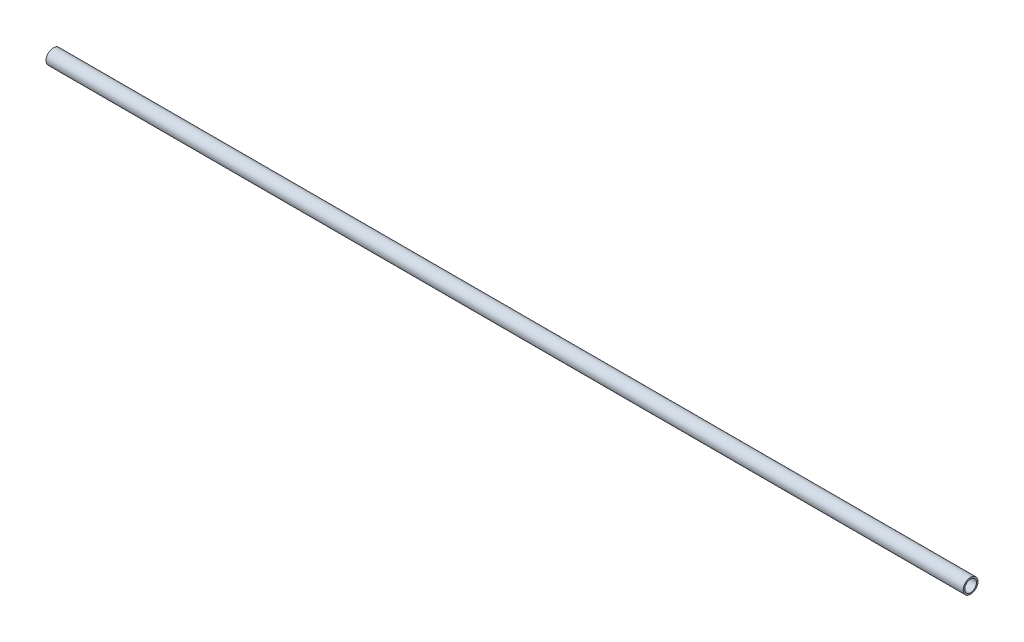
from build123d import *

# Parameters (mm, degrees)
SKETCH2_R           = 8.05
SKETCH2_R_2         = 6.4
BOSS_EXTRUDE1_DEPTH = 1000


with BuildPart() as part:
    # Sketch2 → Boss-Extrude1 (new body)
    with BuildSketch(Plane(origin=(0, 0, 0), x_dir=(0, 0, -1), z_dir=(1, 0, 0))):
        Circle(SKETCH2_R)
        Circle(SKETCH2_R_2, mode=Mode.SUBTRACT)
    extrude(amount=BOSS_EXTRUDE1_DEPTH)


solid = part.part
